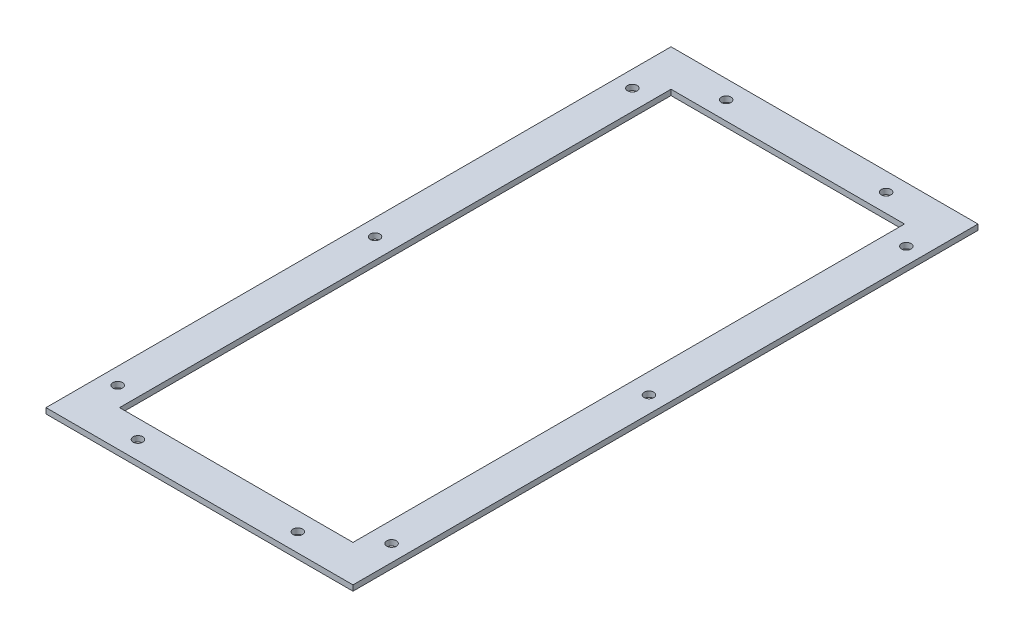
from build123d import *

# Parameters (mm, degrees)
CROQUIS1_W              = 167
CROQUIS1_H              = 340
CROQUIS1_R              = 2.6
SALIENTE_EXTRUIR1_DEPTH = 3
SKETCH1_W               = 127
SKETCH1_H               = 300
CUT_EXTRUDE1_DEPTH      = 10


with BuildPart() as part:
    # Croquis1 → Saliente-Extruir1 (new body)
    with BuildSketch(Plane(origin=(0, 0, 0), x_dir=(1, 0, 0), z_dir=(0, 1, 0))):
        Rectangle(CROQUIS1_W, CROQUIS1_H)
        with Locations(Location((-74.5, 140, 0), (0, 0, 270))):
            Circle(CROQUIS1_R, mode=Mode.SUBTRACT)
        with Locations(Location((-74.5, 0, 0), (0, 0, 270))):
            Circle(CROQUIS1_R, mode=Mode.SUBTRACT)
        with Locations(Location((-74.5, -140, 0), (0, 0, 270))):
            Circle(CROQUIS1_R, mode=Mode.SUBTRACT)
        with Locations(Location((74.5, 140, 0), (0, 0, 270))):
            Circle(CROQUIS1_R, mode=Mode.SUBTRACT)
        with Locations(Location((74.5, -140, 0), (0, 0, 270))):
            Circle(CROQUIS1_R, mode=Mode.SUBTRACT)
        with Locations(Location((74.5, 0, 0), (0, 0, 270))):
            Circle(CROQUIS1_R, mode=Mode.SUBTRACT)
        with Locations(Location((-43.5, 160, 0), (0, 0, 270))):
            Circle(CROQUIS1_R, mode=Mode.SUBTRACT)
        with Locations(Location((43.5, 160, 0), (0, 0, 270))):
            Circle(CROQUIS1_R, mode=Mode.SUBTRACT)
        with Locations(Location((-43.5, -160, 0), (0, 0, 270))):
            Circle(CROQUIS1_R, mode=Mode.SUBTRACT)
        with Locations(Location((43.5, -160, 0), (0, 0, 270))):
            Circle(CROQUIS1_R, mode=Mode.SUBTRACT)
    extrude(amount=SALIENTE_EXTRUIR1_DEPTH)

    # Sketch1 → Cut-Extrude1 (cut)
    with BuildSketch(Plane(origin=(0, 3, 0), x_dir=(1, 0, 0), z_dir=(0, 1, 0))):
        Rectangle(SKETCH1_W, SKETCH1_H)
    extrude(amount=-CUT_EXTRUDE1_DEPTH, mode=Mode.SUBTRACT)


solid = part.part
